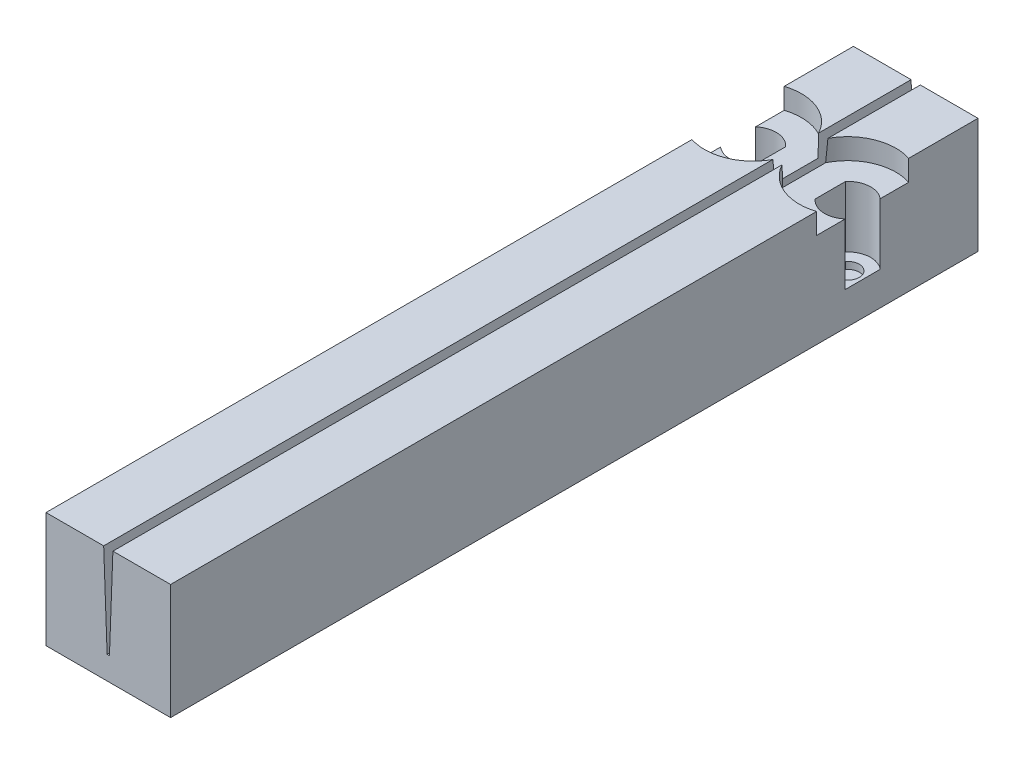
from build123d import *

# Parameters (mm, degrees)
SKETCH1_W           = 54
SKETCH1_H           = 350
BOSS_EXTRUDE1_DEPTH = 50
CUT_EXTRUDE2_DEPTH  = 355.582853505
SKETCH7_R           = 21
SKETCH7_R_2         = 10
CUT_EXTRUDE4_DEPTH  = 9
CUT_EXTRUDE5_DEPTH  = 35.5
CUT_EXTRUDE6_DEPTH  = 3
CUT_EXTRUDE7_DEPTH  = 9


with BuildPart() as part:
    # Sketch1 → Boss-Extrude1 (new body)
    with BuildSketch(Plane(origin=(0, 0, 0), x_dir=(1, 0, 0), z_dir=(0, 1, 0))):
        Rectangle(SKETCH1_W, SKETCH1_H)
    extrude(amount=BOSS_EXTRUDE1_DEPTH)

    # Sketch3 → Cut-Extrude2 (cut, through all)
    with BuildSketch(Plane.XY.offset(175)):
        Polygon((-0.5, 10), (-2, 50), (2, 50), (0.5, 10), align=None)
    extrude(amount=-CUT_EXTRUDE2_DEPTH, mode=Mode.SUBTRACT)

    # Sketch7 → Cut-Extrude4 (cut)
    with BuildSketch(Plane(origin=(0, 50, 0), x_dir=(1, 0, 0), z_dir=(0, 1, 0))):
        with Locations((20.5, 125)):
            Circle(SKETCH7_R)
        with Locations((20.5, 125)):
            Circle(SKETCH7_R_2, mode=Mode.SUBTRACT)
    cut_extrude4 = extrude(amount=-CUT_EXTRUDE4_DEPTH, mode=Mode.SUBTRACT)

    # Sketch9 → Cut-Extrude5 (cut)
    with BuildSketch(Plane(origin=(0, 50, 0), x_dir=(1, 0, 0), z_dir=(0, 1, 0))):
        with BuildLine():
            Line((13, 131.614378278), (13, 118.385621722))
            ThreePointArc((13, 118.385621722), (30.5, 125), (13, 131.614378278))
        make_face()
    cut_extrude5 = extrude(amount=-CUT_EXTRUDE5_DEPTH, mode=Mode.SUBTRACT)

    # Sketch10 → Cut-Extrude6 (cut)
    with BuildSketch(Plane(origin=(0, 14.5, 0), x_dir=(1, 0, 0), z_dir=(0, 1, 0))):
        with BuildLine():
            Line((16.5, 128), (16.5, 122))
            ThreePointArc((16.5, 122), (25.5, 125), (16.5, 128))
        make_face()
    cut_extrude6 = extrude(amount=-CUT_EXTRUDE6_DEPTH, mode=Mode.SUBTRACT)

    # Sketch11 → Cut-Extrude7 (cut)
    with BuildSketch(Plane(origin=(0, 50, 0), x_dir=(1, 0, 0), z_dir=(0, 1, 0))):
        with BuildLine():
            Line((13, 131.614378278), (13, 118.385621722))
            ThreePointArc((13, 118.385621722), (10.5, 125), (13, 131.614378278))
        make_face()
    cut_extrude7 = extrude(amount=-CUT_EXTRUDE7_DEPTH, mode=Mode.SUBTRACT)

    # Mirror1: Cut-Extrude4, Cut-Extrude5, Cut-Extrude6, Cut-Extrude7 across plane
    add(cut_extrude4.mirror(Plane(origin=(0, 0, 0), x_dir=(0, 0, 1), z_dir=(1, 0, 0))), mode=Mode.SUBTRACT)
    add(cut_extrude5.mirror(Plane(origin=(0, 0, 0), x_dir=(0, 0, 1), z_dir=(1, 0, 0))), mode=Mode.SUBTRACT)
    add(cut_extrude6.mirror(Plane(origin=(0, 0, 0), x_dir=(0, 0, 1), z_dir=(1, 0, 0))), mode=Mode.SUBTRACT)
    add(cut_extrude7.mirror(Plane(origin=(0, 0, 0), x_dir=(0, 0, 1), z_dir=(1, 0, 0))), mode=Mode.SUBTRACT)


solid = part.part
